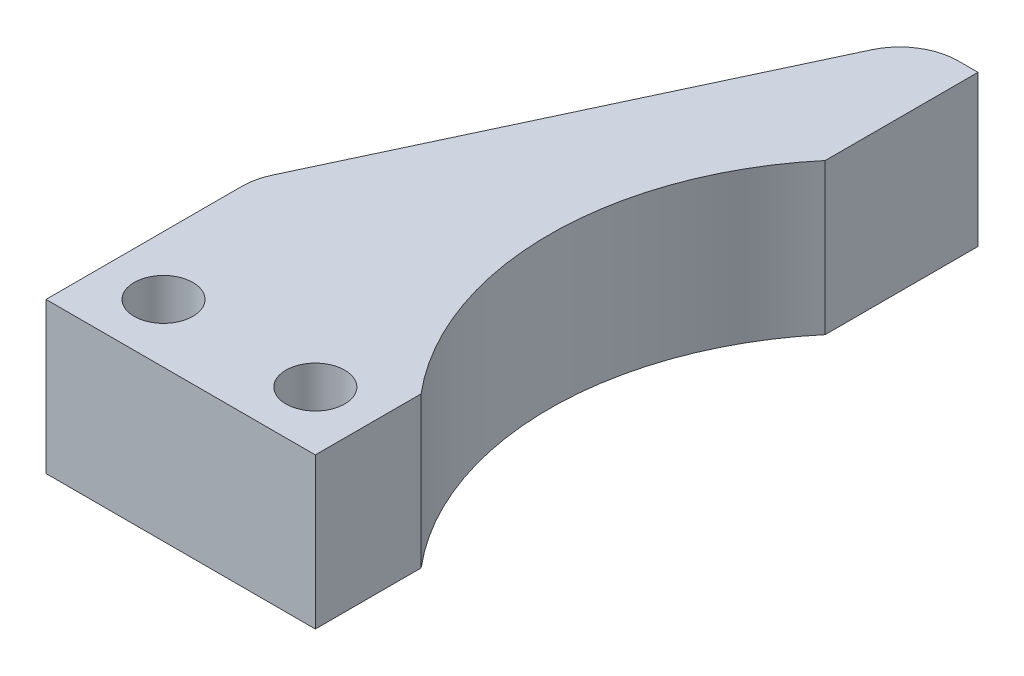
from build123d import *

# Parameters (mm, degrees)
SKETCH1_R           = 1.5
BOSS_EXTRUDE3_DEPTH = 3.85


with BuildPart() as part:
    # Sketch1 → Boss-Extrude3 (new, symmetric)
    # profile 1 of 2: a face of its own
    with BuildSketch(Plane(origin=(0, 0, 0), x_dir=(1, 0, 0), z_dir=(0, 1, 0))):
        with BuildLine():
            Line((-6.875, 19.955976451), (-6.875, -5.4))
            Line((-6.875, -5.4), (0, -5.4))
            Line((0, -5.4), (0, 0))
            ThreePointArc((0, 0), (-3.769352362, 10.315583277), (0, 20.631166554))
            Line((0, 20.631166554), (0, 28.431166554))
            Line((0, 28.431166554), (-1, 28.431166554))
            ThreePointArc((-1, 28.431166554), (-2.610090465, 27.962492036), (-3.717108681, 26.702905684))
            Line((-3.717108681, 26.702905684), (-6.875, 19.955976451))
        make_face()
        with Locations(Location((-3, -2.4, 0), (0, 0, 90))):
            Circle(SKETCH1_R, mode=Mode.SUBTRACT)
    # profile 2 of 2: a face of its own
    with BuildSketch(Plane(origin=(0, 0, 0), x_dir=(1, 0, 0), z_dir=(0, 1, 0))):
        with BuildLine():
            Line((-13.75, 4.6), (-13.75, -5.4))
            Line((-13.75, -5.4), (-6.875, -5.4))
            Line((-6.875, -5.4), (-6.875, 19.955976451))
            Line((-6.875, 19.955976451), (-13.467108681, 5.87173913))
            ThreePointArc((-13.467108681, 5.87173913), (-13.6784233, 5.251411528), (-13.75, 4.6))
        make_face()
        with Locations(Location((-10.75, -2.4, 0), (0, 0, 90))):
            Circle(SKETCH1_R, mode=Mode.SUBTRACT)
    extrude(amount=BOSS_EXTRUDE3_DEPTH, both=True)


solid = part.part
